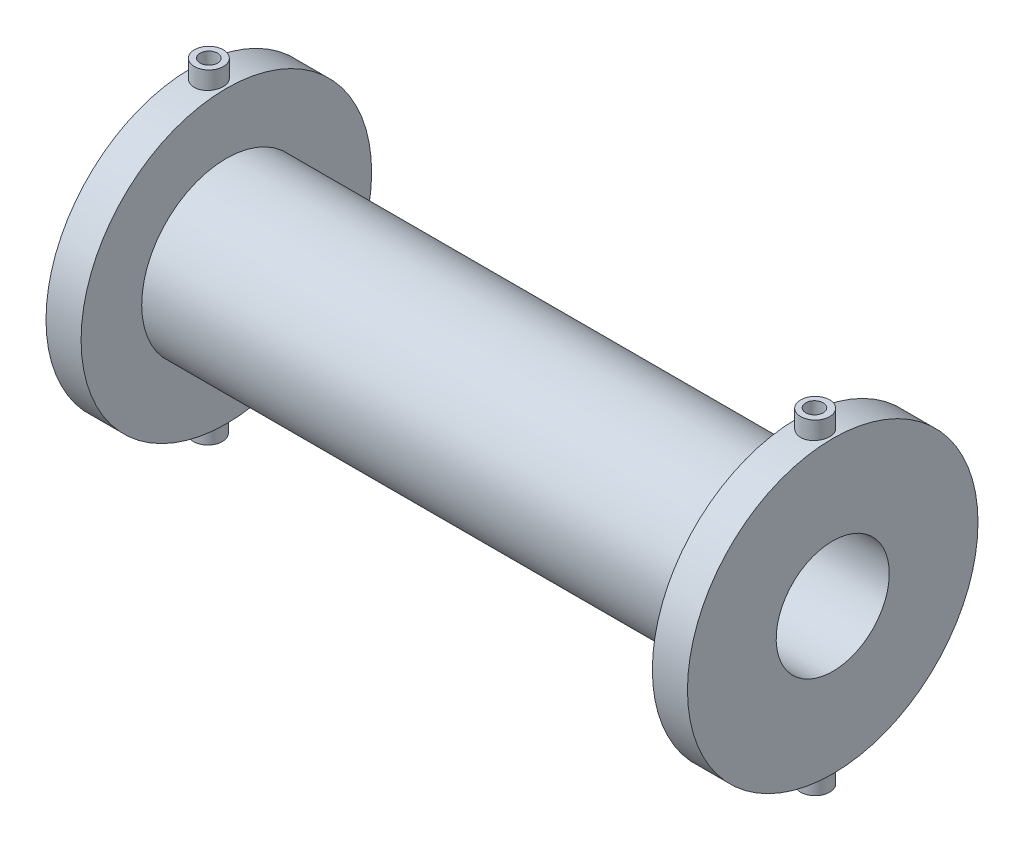
from build123d import *

# Parameters (mm, degrees)
CROQUIS3_R              = 5
SALIENTE_EXTRUIR1_DEPTH = 6
CROQUIS4_R              = 3
CORTAR_EXTRUIR1_DEPTH   = 12
CROQUIS5_R              = 5
SALIENTE_EXTRUIR2_DEPTH = 6
CROQUIS6_R              = 3
CORTAR_EXTRUIR2_DEPTH   = 12
CROQUIS8_R              = 5
SALIENTE_EXTRUIR4_DEPTH = 6
CROQUIS9_R              = 3
CORTAR_EXTRUIR4_DEPTH   = 12
CROQUIS10_R             = 5
SALIENTE_EXTRUIR5_DEPTH = 6
CROQUIS11_R             = 3
CORTAR_EXTRUIR5_DEPTH   = 12


with BuildPart() as part:
    # Camisa → Revolución3 (revolve)
    with BuildSketch(Plane.XY):
        Polygon((-110.61, 19.5), (110.61, 19.5), (110.61, 50.1), (98.51, 50.1), (98.51, 29.193885615), (-98.51, 29.193885615), (-98.51, 50.1), (-110.61, 50.1), align=None)
        Polygon((100.51, 48.1), (108.61, 48.1), (108.61, 21.5), (-108.61, 21.5), (-108.61, 48.1), (-100.51, 48.1), (-100.51, 27.193885615), (100.51, 27.193885615), align=None, mode=Mode.SUBTRACT)
    revolve(axis=Axis((125, 0, 0), (-1, 0, 0)))

    # Croquis3 → Saliente-Extruir1 (add, symmetric)
    with BuildSketch(Plane(origin=(0, 50.1, 0), x_dir=(1, 0, 0), z_dir=(0, 1, 0))):
        with Locations(Location((-104.56, 0, 0), (0, 0, 180))):
            Circle(CROQUIS3_R)
    extrude(amount=SALIENTE_EXTRUIR1_DEPTH, both=True)

    # Croquis4 → Cortar-Extruir1 (cut)
    with BuildSketch(Plane(origin=(0, 56.1, 0), x_dir=(1, 0, 0), z_dir=(0, 1, 0))):
        with Locations(Location((-104.56, 0, 0), (0, 0, 180))):
            Circle(CROQUIS4_R)
    extrude(amount=-CORTAR_EXTRUIR1_DEPTH, mode=Mode.SUBTRACT)

    # Croquis5 → Saliente-Extruir2 (add, symmetric)
    with BuildSketch(Plane(origin=(0, 50.1, 0), x_dir=(1, 0, 0), z_dir=(0, 1, 0))):
        with Locations(Location((104.56, 0, 0), (0, 0, 180))):
            Circle(CROQUIS5_R)
    extrude(amount=SALIENTE_EXTRUIR2_DEPTH, both=True)

    # Croquis6 → Cortar-Extruir2 (cut)
    with BuildSketch(Plane(origin=(0, 56.1, 0), x_dir=(1, 0, 0), z_dir=(0, 1, 0))):
        with Locations(Location((104.311648401, 0, 0), (0, 0, 180))):
            Circle(CROQUIS6_R)
    extrude(amount=-CORTAR_EXTRUIR2_DEPTH, mode=Mode.SUBTRACT)

    # Croquis8 → Saliente-Extruir4 (add, symmetric)
    with BuildSketch(Plane(origin=(0, -50.1, 0), x_dir=(-1, 0, 0), z_dir=(0, -1, 0))):
        with Locations((104.879923699, 0)):
            Circle(CROQUIS8_R)
    extrude(amount=SALIENTE_EXTRUIR4_DEPTH, both=True)

    # Croquis9 → Cortar-Extruir4 (cut)
    with BuildSketch(Plane.XZ.offset(56.1)):
        with Locations((-104.879923699, 0)):
            Circle(CROQUIS9_R)
    extrude(amount=-CORTAR_EXTRUIR4_DEPTH, mode=Mode.SUBTRACT)

    # Croquis10 → Saliente-Extruir5 (add, symmetric)
    with BuildSketch(Plane(origin=(0, -50.1, 0), x_dir=(-1, 0, 0), z_dir=(0, -1, 0))):
        with Locations((-104.56, 0)):
            Circle(CROQUIS10_R)
    extrude(amount=SALIENTE_EXTRUIR5_DEPTH, both=True)

    # Croquis11 → Cortar-Extruir5 (cut)
    with BuildSketch(Plane.XZ.offset(56.1)):
        with Locations((104.56, 0)):
            Circle(CROQUIS11_R)
    extrude(amount=-CORTAR_EXTRUIR5_DEPTH, mode=Mode.SUBTRACT)


solid = part.part
